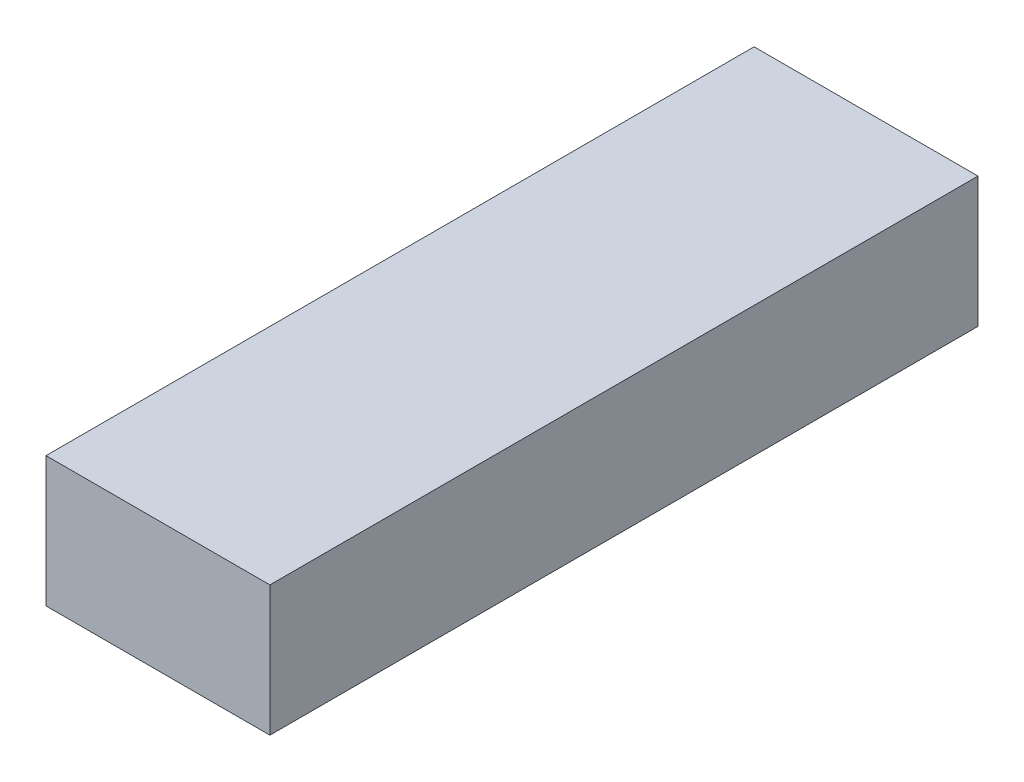
from build123d import *

# Parameters (mm, degrees)
SKETCH1_W           = 43
SKETCH1_H           = 136
BOSS_EXTRUDE1_DEPTH = 25


with BuildPart() as part:
    # Sketch1 → Boss-Extrude1 (new body)
    with BuildSketch(Plane(origin=(0, 0, 0), x_dir=(1, 0, 0), z_dir=(0, 1, 0))):
        with Locations((21.5, 68)):
            Rectangle(SKETCH1_W, SKETCH1_H)
    extrude(amount=BOSS_EXTRUDE1_DEPTH)


solid = part.part
